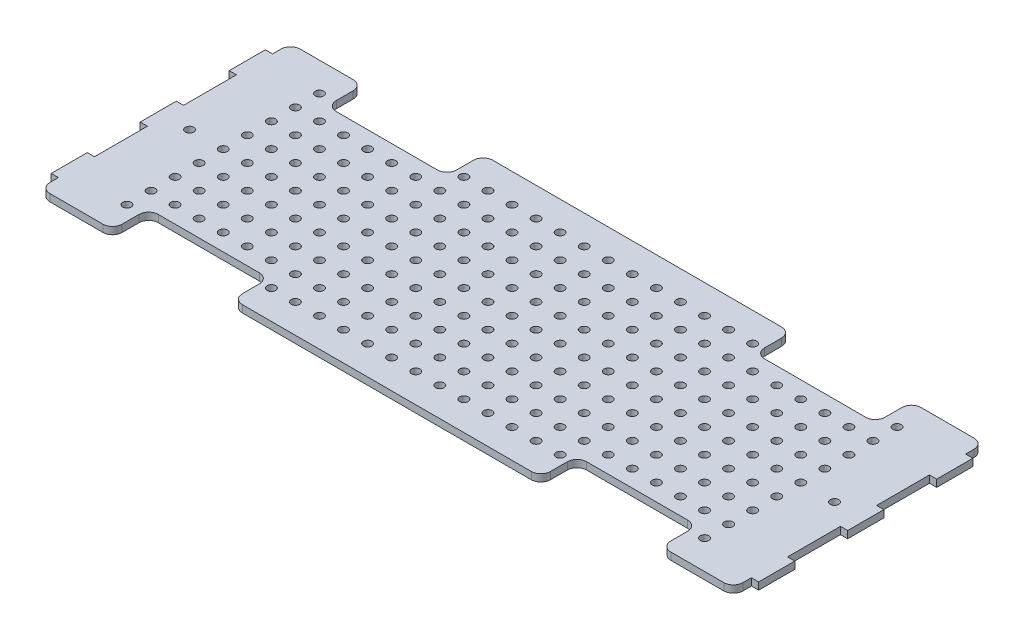
from build123d import *

# Parameters (mm, degrees)
EXTRUDE_1_DEPTH      = 1.5
EXTRUDE_1_DEPTH_BACK = 1.5
SKETCH_1_R           = 1.75
FILLET_1_R           = 4


with BuildPart() as part:
    # Эскиз1 → Бобышка-Вытянуть1 (new, two sides: drawn at the far end of the back side and taken through both)
    with BuildSketch(Plane(origin=(0, 0, 0), x_dir=(1, 0, 0), z_dir=(0, 1, 0)).offset(-EXTRUDE_1_DEPTH_BACK)):
        with BuildLine():
            ThreePointArc((-144, -48), (-142.828427125, -50.828427125), (-140, -52))
            Line((-140, -52), (-114, -52))
            Line((-114, -52), (-114, -41))
            ThreePointArc((-114, -41), (-112.828427125, -38.171572875), (-110, -37))
            Line((-110, -37), (-68, -37))
            ThreePointArc((-68, -37), (-65.171572875, -38.171572875), (-64, -41))
            Line((-64, -41), (-64, -52))
            Line((-64, -52), (64, -52))
            Line((64, -52), (64, -41))
            ThreePointArc((64, -41), (65.171572875, -38.171572875), (68, -37))
            Line((68, -37), (110, -37))
            ThreePointArc((110, -37), (112.828427125, -38.171572875), (114, -41))
            Line((114, -41), (114, -52))
            Line((114, -52), (140, -52))
            ThreePointArc((140, -52), (142.828427125, -50.828427125), (144, -48))
            Line((144, -48), (144, -44.5))
            Line((144, -44.5), (147, -44.5))
            Line((147, -44.5), (147, -29.5))
            Line((147, -29.5), (144, -29.5))
            Line((144, -29.5), (144, -7.5))
            Line((144, -7.5), (147, -7.5))
            Line((147, -7.5), (147, 7.5))
            Line((147, 7.5), (144, 7.5))
            Line((144, 7.5), (144, 18.5))
            Line((144, 18.5), (144, 29.5))
            Line((144, 29.5), (147, 29.5))
            Line((147, 29.5), (147, 44.5))
            Line((147, 44.5), (144, 44.5))
            Line((144, 44.5), (144, 48))
            ThreePointArc((144, 48), (142.828427125, 50.828427125), (140, 52))
            Line((140, 52), (114, 52))
            Line((114, 52), (114, 41))
            ThreePointArc((114, 41), (112.828427125, 38.171572875), (110, 37))
            Line((110, 37), (68, 37))
            ThreePointArc((68, 37), (65.171572875, 38.171572875), (64, 41))
            Line((64, 41), (64, 52))
            Line((64, 52), (-64, 52))
            Line((-64, 52), (-64, 41))
            ThreePointArc((-64, 41), (-65.171572875, 38.171572875), (-68, 37))
            Line((-68, 37), (-110, 37))
            ThreePointArc((-110, 37), (-112.828427125, 38.171572875), (-114, 41))
            Line((-114, 41), (-114, 48))
            ThreePointArc((-114, 48), (-115.171572875, 50.828427125), (-118, 52))
            Line((-118, 52), (-140, 52))
            ThreePointArc((-140, 52), (-142.828427125, 50.828427125), (-144, 48))
            Line((-144, 48), (-144, 44.5))
            Line((-144, 44.5), (-147, 44.5))
            Line((-147, 44.5), (-147, 29.5))
            Line((-147, 29.5), (-144, 29.5))
            Line((-144, 29.5), (-144, 18.5))
            Line((-144, 18.5), (-144, 7.5))
            Line((-144, 7.5), (-147, 7.5))
            Line((-147, 7.5), (-147, -7.5))
            Line((-147, -7.5), (-144, -7.5))
            Line((-144, -7.5), (-144, -29.5))
            Line((-144, -29.5), (-147, -29.5))
            Line((-147, -29.5), (-147, -44.5))
            Line((-147, -44.5), (-144, -44.5))
            Line((-144, -44.5), (-144, -48))
        make_face()
        with Locations((-120, -40)):
            Circle(SKETCH_1_R, mode=Mode.SUBTRACT)
        with Locations((-120, -30)):
            Circle(SKETCH_1_R, mode=Mode.SUBTRACT)
        with Locations((-110, -30)):
            Circle(SKETCH_1_R, mode=Mode.SUBTRACT)
        with Locations((-100, -30)):
            Circle(SKETCH_1_R, mode=Mode.SUBTRACT)
        with Locations((-90, -30)):
            Circle(SKETCH_1_R, mode=Mode.SUBTRACT)
        with Locations((-80, -30)):
            Circle(SKETCH_1_R, mode=Mode.SUBTRACT)
        with Locations((-60, -40)):
            Circle(SKETCH_1_R, mode=Mode.SUBTRACT)
        with Locations((-50, -40)):
            Circle(SKETCH_1_R, mode=Mode.SUBTRACT)
        with Locations((-40, -40)):
            Circle(SKETCH_1_R, mode=Mode.SUBTRACT)
        with Locations((-30, -40)):
            Circle(SKETCH_1_R, mode=Mode.SUBTRACT)
        with Locations((-20, -40)):
            Circle(SKETCH_1_R, mode=Mode.SUBTRACT)
        with Locations((-10, -40)):
            Circle(SKETCH_1_R, mode=Mode.SUBTRACT)
        with Locations((-70, -30)):
            Circle(SKETCH_1_R, mode=Mode.SUBTRACT)
        with Locations((-60, -30)):
            Circle(SKETCH_1_R, mode=Mode.SUBTRACT)
        with Locations((-50, -30)):
            Circle(SKETCH_1_R, mode=Mode.SUBTRACT)
        with Locations((-40, -30)):
            Circle(SKETCH_1_R, mode=Mode.SUBTRACT)
        with Locations((-30, -30)):
            Circle(SKETCH_1_R, mode=Mode.SUBTRACT)
        with Locations((-20, -30)):
            Circle(SKETCH_1_R, mode=Mode.SUBTRACT)
        with Locations((-10, -30)):
            Circle(SKETCH_1_R, mode=Mode.SUBTRACT)
        with Locations((-120, -20)):
            Circle(SKETCH_1_R, mode=Mode.SUBTRACT)
        with Locations((-110, -20)):
            Circle(SKETCH_1_R, mode=Mode.SUBTRACT)
        with Locations((-100, -20)):
            Circle(SKETCH_1_R, mode=Mode.SUBTRACT)
        with Locations((-90, -20)):
            Circle(SKETCH_1_R, mode=Mode.SUBTRACT)
        with Locations((-80, -20)):
            Circle(SKETCH_1_R, mode=Mode.SUBTRACT)
        with Locations((-120, -10)):
            Circle(SKETCH_1_R, mode=Mode.SUBTRACT)
        with Locations((-120, 0)):
            Circle(SKETCH_1_R, mode=Mode.SUBTRACT)
        with Locations((-110, -10)):
            Circle(SKETCH_1_R, mode=Mode.SUBTRACT)
        with Locations((-100, -10)):
            Circle(SKETCH_1_R, mode=Mode.SUBTRACT)
        with Locations((-90, -10)):
            Circle(SKETCH_1_R, mode=Mode.SUBTRACT)
        with Locations((-80, -10)):
            Circle(SKETCH_1_R, mode=Mode.SUBTRACT)
        with Locations((-110, 0)):
            Circle(SKETCH_1_R, mode=Mode.SUBTRACT)
        with Locations((-100, 0)):
            Circle(SKETCH_1_R, mode=Mode.SUBTRACT)
        with Locations((-90, 0)):
            Circle(SKETCH_1_R, mode=Mode.SUBTRACT)
        with Locations((-80, 0)):
            Circle(SKETCH_1_R, mode=Mode.SUBTRACT)
        with Locations((-70, -20)):
            Circle(SKETCH_1_R, mode=Mode.SUBTRACT)
        with Locations((-60, -20)):
            Circle(SKETCH_1_R, mode=Mode.SUBTRACT)
        with Locations((-50, -20)):
            Circle(SKETCH_1_R, mode=Mode.SUBTRACT)
        with Locations((-40, -20)):
            Circle(SKETCH_1_R, mode=Mode.SUBTRACT)
        with Locations((-30, -20)):
            Circle(SKETCH_1_R, mode=Mode.SUBTRACT)
        with Locations((-20, -20)):
            Circle(SKETCH_1_R, mode=Mode.SUBTRACT)
        with Locations((-10, -20)):
            Circle(SKETCH_1_R, mode=Mode.SUBTRACT)
        with Locations((-70, -10)):
            Circle(SKETCH_1_R, mode=Mode.SUBTRACT)
        with Locations((-60, -10)):
            Circle(SKETCH_1_R, mode=Mode.SUBTRACT)
        with Locations((-50, -10)):
            Circle(SKETCH_1_R, mode=Mode.SUBTRACT)
        with Locations((-40, -10)):
            Circle(SKETCH_1_R, mode=Mode.SUBTRACT)
        with Locations((-70, 0)):
            Circle(SKETCH_1_R, mode=Mode.SUBTRACT)
        with Locations((-60, 0)):
            Circle(SKETCH_1_R, mode=Mode.SUBTRACT)
        with Locations((-50, 0)):
            Circle(SKETCH_1_R, mode=Mode.SUBTRACT)
        with Locations((-40, 0)):
            Circle(SKETCH_1_R, mode=Mode.SUBTRACT)
        with Locations((-30, -10)):
            Circle(SKETCH_1_R, mode=Mode.SUBTRACT)
        with Locations((-20, -10)):
            Circle(SKETCH_1_R, mode=Mode.SUBTRACT)
        with Locations((-10, -10)):
            Circle(SKETCH_1_R, mode=Mode.SUBTRACT)
        with Locations((-30, 0)):
            Circle(SKETCH_1_R, mode=Mode.SUBTRACT)
        with Locations((-20, 0)):
            Circle(SKETCH_1_R, mode=Mode.SUBTRACT)
        with Locations((-10, 0)):
            Circle(SKETCH_1_R, mode=Mode.SUBTRACT)
        with Locations((0, -40)):
            Circle(SKETCH_1_R, mode=Mode.SUBTRACT)
        with Locations((10, -40)):
            Circle(SKETCH_1_R, mode=Mode.SUBTRACT)
        with Locations((20, -40)):
            Circle(SKETCH_1_R, mode=Mode.SUBTRACT)
        with Locations((30, -40)):
            Circle(SKETCH_1_R, mode=Mode.SUBTRACT)
        with Locations((40, -40)):
            Circle(SKETCH_1_R, mode=Mode.SUBTRACT)
        with Locations((50, -40)):
            Circle(SKETCH_1_R, mode=Mode.SUBTRACT)
        with Locations((60, -40)):
            Circle(SKETCH_1_R, mode=Mode.SUBTRACT)
        with Locations((0, -30)):
            Circle(SKETCH_1_R, mode=Mode.SUBTRACT)
        with Locations((10, -30)):
            Circle(SKETCH_1_R, mode=Mode.SUBTRACT)
        with Locations((20, -30)):
            Circle(SKETCH_1_R, mode=Mode.SUBTRACT)
        with Locations((30, -30)):
            Circle(SKETCH_1_R, mode=Mode.SUBTRACT)
        with Locations((40, -30)):
            Circle(SKETCH_1_R, mode=Mode.SUBTRACT)
        with Locations((50, -30)):
            Circle(SKETCH_1_R, mode=Mode.SUBTRACT)
        with Locations((60, -30)):
            Circle(SKETCH_1_R, mode=Mode.SUBTRACT)
        with Locations((70, -30)):
            Circle(SKETCH_1_R, mode=Mode.SUBTRACT)
        with Locations((120, -40)):
            Circle(SKETCH_1_R, mode=Mode.SUBTRACT)
        with Locations((80, -30)):
            Circle(SKETCH_1_R, mode=Mode.SUBTRACT)
        with Locations((90, -30)):
            Circle(SKETCH_1_R, mode=Mode.SUBTRACT)
        with Locations((100, -30)):
            Circle(SKETCH_1_R, mode=Mode.SUBTRACT)
        with Locations((110, -30)):
            Circle(SKETCH_1_R, mode=Mode.SUBTRACT)
        with Locations((120, -30)):
            Circle(SKETCH_1_R, mode=Mode.SUBTRACT)
        with Locations((0, -20)):
            Circle(SKETCH_1_R, mode=Mode.SUBTRACT)
        with Locations((10, -20)):
            Circle(SKETCH_1_R, mode=Mode.SUBTRACT)
        with Locations((20, -20)):
            Circle(SKETCH_1_R, mode=Mode.SUBTRACT)
        with Locations((30, -20)):
            Circle(SKETCH_1_R, mode=Mode.SUBTRACT)
        with Locations((40, -20)):
            Circle(SKETCH_1_R, mode=Mode.SUBTRACT)
        with Locations((50, -20)):
            Circle(SKETCH_1_R, mode=Mode.SUBTRACT)
        with Locations((60, -20)):
            Circle(SKETCH_1_R, mode=Mode.SUBTRACT)
        with Locations((70, -20)):
            Circle(SKETCH_1_R, mode=Mode.SUBTRACT)
        with Locations((0, -10)):
            Circle(SKETCH_1_R, mode=Mode.SUBTRACT)
        with Locations((10, -10)):
            Circle(SKETCH_1_R, mode=Mode.SUBTRACT)
        with Locations((20, -10)):
            Circle(SKETCH_1_R, mode=Mode.SUBTRACT)
        with Locations((30, -10)):
            Circle(SKETCH_1_R, mode=Mode.SUBTRACT)
        with BuildLine():
            ThreePointArc((11.75, 0), (10, -1.75), (8.25, 0))
            ThreePointArc((8.25, 0), (10, 1.75), (11.75, 0))
        make_face(mode=Mode.SUBTRACT)
        with BuildLine():
            ThreePointArc((21.75, 0), (20, -1.75), (18.25, 0))
            ThreePointArc((18.25, 0), (20, 1.75), (21.75, 0))
        make_face(mode=Mode.SUBTRACT)
        with BuildLine():
            ThreePointArc((31.75, 0), (30, -1.75), (28.25, 0))
            ThreePointArc((28.25, 0), (30, 1.75), (31.75, 0))
        make_face(mode=Mode.SUBTRACT)
        with Locations((40, -10)):
            Circle(SKETCH_1_R, mode=Mode.SUBTRACT)
        with Locations((50, -10)):
            Circle(SKETCH_1_R, mode=Mode.SUBTRACT)
        with Locations((60, -10)):
            Circle(SKETCH_1_R, mode=Mode.SUBTRACT)
        with Locations((70, -10)):
            Circle(SKETCH_1_R, mode=Mode.SUBTRACT)
        with BuildLine():
            ThreePointArc((41.75, 0), (40, -1.75), (38.25, 0))
            ThreePointArc((38.25, 0), (40, 1.75), (41.75, 0))
        make_face(mode=Mode.SUBTRACT)
        with BuildLine():
            ThreePointArc((51.75, 0), (50, -1.75), (48.25, 0))
            ThreePointArc((48.25, 0), (50, 1.75), (51.75, 0))
        make_face(mode=Mode.SUBTRACT)
        with BuildLine():
            ThreePointArc((61.75, 0), (60, -1.75), (58.25, 0))
            ThreePointArc((58.25, 0), (60, 1.75), (61.75, 0))
        make_face(mode=Mode.SUBTRACT)
        with BuildLine():
            ThreePointArc((71.75, 0), (70, -1.75), (68.25, 0))
            ThreePointArc((68.25, 0), (70, 1.75), (71.75, 0))
        make_face(mode=Mode.SUBTRACT)
        with Locations((80, -20)):
            Circle(SKETCH_1_R, mode=Mode.SUBTRACT)
        with Locations((90, -20)):
            Circle(SKETCH_1_R, mode=Mode.SUBTRACT)
        with Locations((100, -20)):
            Circle(SKETCH_1_R, mode=Mode.SUBTRACT)
        with Locations((110, -20)):
            Circle(SKETCH_1_R, mode=Mode.SUBTRACT)
        with Locations((120, -20)):
            Circle(SKETCH_1_R, mode=Mode.SUBTRACT)
        with Locations((80, -10)):
            Circle(SKETCH_1_R, mode=Mode.SUBTRACT)
        with Locations((90, -10)):
            Circle(SKETCH_1_R, mode=Mode.SUBTRACT)
        with Locations((100, -10)):
            Circle(SKETCH_1_R, mode=Mode.SUBTRACT)
        with Locations((110, -10)):
            Circle(SKETCH_1_R, mode=Mode.SUBTRACT)
        with BuildLine():
            ThreePointArc((81.75, 0), (80, -1.75), (78.25, 0))
            ThreePointArc((78.25, 0), (80, 1.75), (81.75, 0))
        make_face(mode=Mode.SUBTRACT)
        with BuildLine():
            ThreePointArc((91.75, 0), (90, -1.75), (88.25, 0))
            ThreePointArc((88.25, 0), (90, 1.75), (91.75, 0))
        make_face(mode=Mode.SUBTRACT)
        with BuildLine():
            ThreePointArc((101.75, 0), (100, -1.75), (98.25, 0))
            ThreePointArc((98.25, 0), (100, 1.75), (101.75, 0))
        make_face(mode=Mode.SUBTRACT)
        with BuildLine():
            ThreePointArc((111.75, 0), (110, -1.75), (108.25, 0))
            ThreePointArc((108.25, 0), (110, 1.75), (111.75, 0))
        make_face(mode=Mode.SUBTRACT)
        with Locations((120, -10)):
            Circle(SKETCH_1_R, mode=Mode.SUBTRACT)
        with Locations((-134, 0)):
            Circle(SKETCH_1_R, mode=Mode.SUBTRACT)
        with Locations((-120, 10)):
            Circle(SKETCH_1_R, mode=Mode.SUBTRACT)
        with Locations((-110, 10)):
            Circle(SKETCH_1_R, mode=Mode.SUBTRACT)
        with Locations((-100, 10)):
            Circle(SKETCH_1_R, mode=Mode.SUBTRACT)
        with Locations((-90, 10)):
            Circle(SKETCH_1_R, mode=Mode.SUBTRACT)
        with Locations((-80, 10)):
            Circle(SKETCH_1_R, mode=Mode.SUBTRACT)
        with Locations((-120, 20)):
            Circle(SKETCH_1_R, mode=Mode.SUBTRACT)
        with Locations((-110, 20)):
            Circle(SKETCH_1_R, mode=Mode.SUBTRACT)
        with Locations((-100, 20)):
            Circle(SKETCH_1_R, mode=Mode.SUBTRACT)
        with Locations((-90, 20)):
            Circle(SKETCH_1_R, mode=Mode.SUBTRACT)
        with Locations((-80, 20)):
            Circle(SKETCH_1_R, mode=Mode.SUBTRACT)
        with Locations((-70, 10)):
            Circle(SKETCH_1_R, mode=Mode.SUBTRACT)
        with Locations((-60, 10)):
            Circle(SKETCH_1_R, mode=Mode.SUBTRACT)
        with Locations((-50, 10)):
            Circle(SKETCH_1_R, mode=Mode.SUBTRACT)
        with Locations((-40, 10)):
            Circle(SKETCH_1_R, mode=Mode.SUBTRACT)
        with Locations((-30, 10)):
            Circle(SKETCH_1_R, mode=Mode.SUBTRACT)
        with Locations((-20, 10)):
            Circle(SKETCH_1_R, mode=Mode.SUBTRACT)
        with Locations((-10, 10)):
            Circle(SKETCH_1_R, mode=Mode.SUBTRACT)
        with Locations((-70, 20)):
            Circle(SKETCH_1_R, mode=Mode.SUBTRACT)
        with Locations((-60, 20)):
            Circle(SKETCH_1_R, mode=Mode.SUBTRACT)
        with Locations((-50, 20)):
            Circle(SKETCH_1_R, mode=Mode.SUBTRACT)
        with Locations((-40, 20)):
            Circle(SKETCH_1_R, mode=Mode.SUBTRACT)
        with Locations((-30, 20)):
            Circle(SKETCH_1_R, mode=Mode.SUBTRACT)
        with Locations((-20, 20)):
            Circle(SKETCH_1_R, mode=Mode.SUBTRACT)
        with Locations((-10, 20)):
            Circle(SKETCH_1_R, mode=Mode.SUBTRACT)
        with Locations((-120, 30)):
            Circle(SKETCH_1_R, mode=Mode.SUBTRACT)
        with Locations((-110, 30)):
            Circle(SKETCH_1_R, mode=Mode.SUBTRACT)
        with Locations((-100, 30)):
            Circle(SKETCH_1_R, mode=Mode.SUBTRACT)
        with Locations((-90, 30)):
            Circle(SKETCH_1_R, mode=Mode.SUBTRACT)
        with Locations((-80, 30)):
            Circle(SKETCH_1_R, mode=Mode.SUBTRACT)
        with Locations((-120, 40)):
            Circle(SKETCH_1_R, mode=Mode.SUBTRACT)
        with Locations((-70, 30)):
            Circle(SKETCH_1_R, mode=Mode.SUBTRACT)
        with Locations((-60, 30)):
            Circle(SKETCH_1_R, mode=Mode.SUBTRACT)
        with Locations((-50, 30)):
            Circle(SKETCH_1_R, mode=Mode.SUBTRACT)
        with Locations((-40, 30)):
            Circle(SKETCH_1_R, mode=Mode.SUBTRACT)
        with Locations((-30, 30)):
            Circle(SKETCH_1_R, mode=Mode.SUBTRACT)
        with Locations((-20, 30)):
            Circle(SKETCH_1_R, mode=Mode.SUBTRACT)
        with Locations((-10, 30)):
            Circle(SKETCH_1_R, mode=Mode.SUBTRACT)
        with Locations((-60, 40)):
            Circle(SKETCH_1_R, mode=Mode.SUBTRACT)
        with Locations((-50, 40)):
            Circle(SKETCH_1_R, mode=Mode.SUBTRACT)
        with Locations((-40, 40)):
            Circle(SKETCH_1_R, mode=Mode.SUBTRACT)
        with Locations((-30, 40)):
            Circle(SKETCH_1_R, mode=Mode.SUBTRACT)
        with Locations((-20, 40)):
            Circle(SKETCH_1_R, mode=Mode.SUBTRACT)
        with Locations((-10, 40)):
            Circle(SKETCH_1_R, mode=Mode.SUBTRACT)
        Circle(SKETCH_1_R, mode=Mode.SUBTRACT)
        with Locations((0, 10)):
            Circle(SKETCH_1_R, mode=Mode.SUBTRACT)
        with Locations((10, 10)):
            Circle(SKETCH_1_R, mode=Mode.SUBTRACT)
        with Locations((20, 10)):
            Circle(SKETCH_1_R, mode=Mode.SUBTRACT)
        with Locations((30, 10)):
            Circle(SKETCH_1_R, mode=Mode.SUBTRACT)
        with Locations((40, 10)):
            Circle(SKETCH_1_R, mode=Mode.SUBTRACT)
        with Locations((50, 10)):
            Circle(SKETCH_1_R, mode=Mode.SUBTRACT)
        with Locations((60, 10)):
            Circle(SKETCH_1_R, mode=Mode.SUBTRACT)
        with Locations((70, 10)):
            Circle(SKETCH_1_R, mode=Mode.SUBTRACT)
        with Locations((0, 20)):
            Circle(SKETCH_1_R, mode=Mode.SUBTRACT)
        with Locations((10, 20)):
            Circle(SKETCH_1_R, mode=Mode.SUBTRACT)
        with Locations((20, 20)):
            Circle(SKETCH_1_R, mode=Mode.SUBTRACT)
        with Locations((30, 20)):
            Circle(SKETCH_1_R, mode=Mode.SUBTRACT)
        with Locations((40, 20)):
            Circle(SKETCH_1_R, mode=Mode.SUBTRACT)
        with Locations((50, 20)):
            Circle(SKETCH_1_R, mode=Mode.SUBTRACT)
        with Locations((60, 20)):
            Circle(SKETCH_1_R, mode=Mode.SUBTRACT)
        with Locations((70, 20)):
            Circle(SKETCH_1_R, mode=Mode.SUBTRACT)
        with Locations((80, 10)):
            Circle(SKETCH_1_R, mode=Mode.SUBTRACT)
        with Locations((90, 10)):
            Circle(SKETCH_1_R, mode=Mode.SUBTRACT)
        with Locations((100, 10)):
            Circle(SKETCH_1_R, mode=Mode.SUBTRACT)
        with Locations((110, 10)):
            Circle(SKETCH_1_R, mode=Mode.SUBTRACT)
        with BuildLine():
            ThreePointArc((121.75, 0), (120, -1.75), (118.25, 0))
            ThreePointArc((118.25, 0), (120, 1.75), (121.75, 0))
        make_face(mode=Mode.SUBTRACT)
        with Locations((134, 0)):
            Circle(SKETCH_1_R, mode=Mode.SUBTRACT)
        with Locations((120, 10)):
            Circle(SKETCH_1_R, mode=Mode.SUBTRACT)
        with Locations((80, 20)):
            Circle(SKETCH_1_R, mode=Mode.SUBTRACT)
        with Locations((90, 20)):
            Circle(SKETCH_1_R, mode=Mode.SUBTRACT)
        with Locations((100, 20)):
            Circle(SKETCH_1_R, mode=Mode.SUBTRACT)
        with Locations((110, 20)):
            Circle(SKETCH_1_R, mode=Mode.SUBTRACT)
        with Locations((120, 20)):
            Circle(SKETCH_1_R, mode=Mode.SUBTRACT)
        with Locations((0, 30)):
            Circle(SKETCH_1_R, mode=Mode.SUBTRACT)
        with Locations((10, 30)):
            Circle(SKETCH_1_R, mode=Mode.SUBTRACT)
        with Locations((20, 30)):
            Circle(SKETCH_1_R, mode=Mode.SUBTRACT)
        with Locations((30, 30)):
            Circle(SKETCH_1_R, mode=Mode.SUBTRACT)
        with Locations((40, 30)):
            Circle(SKETCH_1_R, mode=Mode.SUBTRACT)
        with Locations((50, 30)):
            Circle(SKETCH_1_R, mode=Mode.SUBTRACT)
        with Locations((60, 30)):
            Circle(SKETCH_1_R, mode=Mode.SUBTRACT)
        with Locations((70, 30)):
            Circle(SKETCH_1_R, mode=Mode.SUBTRACT)
        with Locations((0, 40)):
            Circle(SKETCH_1_R, mode=Mode.SUBTRACT)
        with Locations((10, 40)):
            Circle(SKETCH_1_R, mode=Mode.SUBTRACT)
        with Locations((20, 40)):
            Circle(SKETCH_1_R, mode=Mode.SUBTRACT)
        with Locations((30, 40)):
            Circle(SKETCH_1_R, mode=Mode.SUBTRACT)
        with Locations((40, 40)):
            Circle(SKETCH_1_R, mode=Mode.SUBTRACT)
        with Locations((50, 40)):
            Circle(SKETCH_1_R, mode=Mode.SUBTRACT)
        with Locations((60, 40)):
            Circle(SKETCH_1_R, mode=Mode.SUBTRACT)
        with Locations((80, 30)):
            Circle(SKETCH_1_R, mode=Mode.SUBTRACT)
        with Locations((90, 30)):
            Circle(SKETCH_1_R, mode=Mode.SUBTRACT)
        with Locations((100, 30)):
            Circle(SKETCH_1_R, mode=Mode.SUBTRACT)
        with Locations((110, 30)):
            Circle(SKETCH_1_R, mode=Mode.SUBTRACT)
        with Locations((120, 30)):
            Circle(SKETCH_1_R, mode=Mode.SUBTRACT)
        with Locations((120, 40)):
            Circle(SKETCH_1_R, mode=Mode.SUBTRACT)
    extrude(amount=EXTRUDE_1_DEPTH + EXTRUDE_1_DEPTH_BACK)

    # Скругление1
    fillet_1_edges = [part.edges().sort_by_distance(p)[0] for p in [
        (114, 0, -52),
        (64, 0, -52),
        (-64, 0, -52),
        (114, 0, 52),
        (64, 0, 52),
        (-64, 0, 52),
        (-114, 0, 52),
    ]]
    fillet(fillet_1_edges, radius=FILLET_1_R)


solid = part.part
